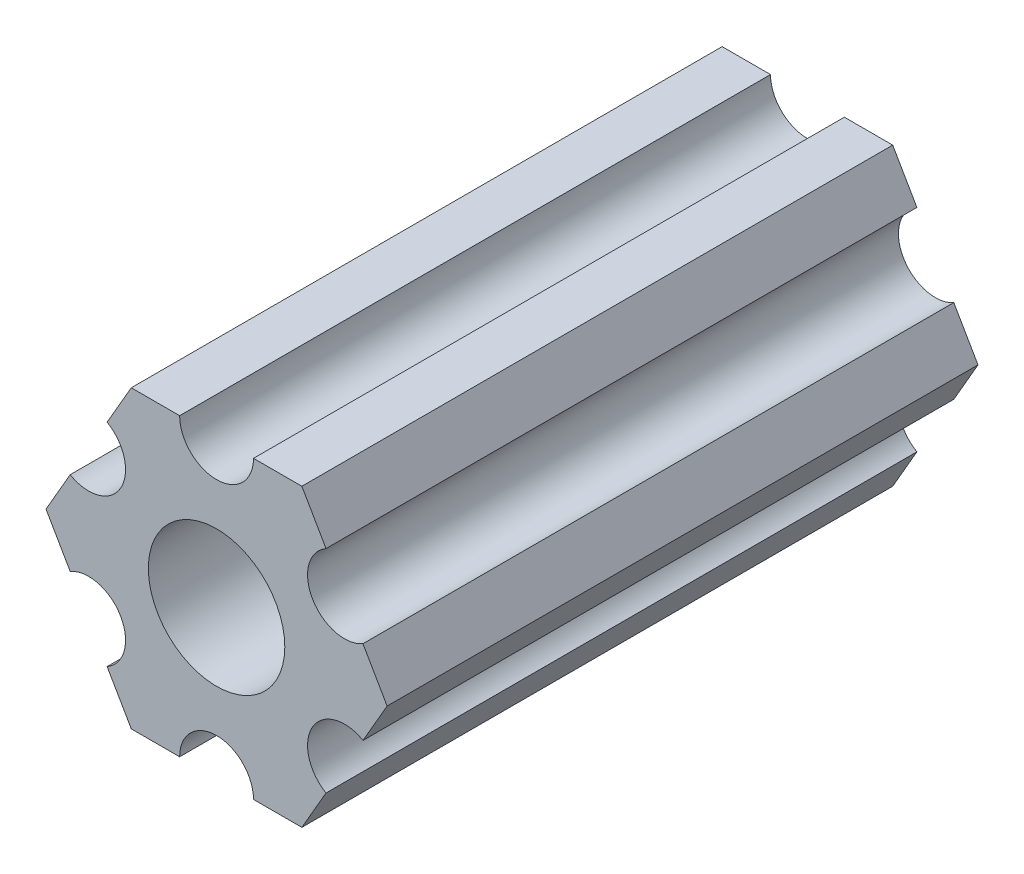
from build123d import *

# Parameters (mm, degrees)
SKETCH1_R           = 2.9337
BOSS_EXTRUDE1_DEPTH = 25.4


with BuildPart() as part:
    # Sketch1 → Boss-Extrude1 (new body)
    with BuildSketch(Plane(origin=(0, 0, 0), x_dir=(-1, 0, 0), z_dir=(0, 0, -1))):
        with BuildLine():
            Line((-4.70551159, -4.549815043), (-3.666174521, -6.349999904))
            Line((-3.666174521, -6.349999904), (-1.587500385, -6.349999904))
            ThreePointArc((-1.587500385, -6.349999904), (-3.85e-07, -4.762499904), (1.587499615, -6.349999904))
            Line((1.587499615, -6.349999904), (3.666173825, -6.349999904))
            Line((3.666173825, -6.349999904), (4.705510942, -4.54981524))
            ThreePointArc((4.705510942, -4.54981524), (4.124445629, -2.381249907), (6.293010962, -1.800184594))
            Line((6.293010962, -1.800184594), (7.332348079, 7e-08))
            Line((7.332348079, 7e-08), (6.293011217, 1.800184685))
            ThreePointArc((6.293011217, 1.800184685), (4.124445939, 2.381250203), (4.705511457, 4.549815481))
            Line((4.705511457, 4.549815481), (3.666174521, 6.350000222))
            Line((3.666174521, 6.350000222), (1.587500385, 6.350000222))
            ThreePointArc((1.587500385, 6.350000222), (3.85e-07, 4.762500222), (-1.587499615, 6.350000222))
            Line((-1.587499615, 6.350000222), (-3.666173825, 6.350000222))
            Line((-3.666173825, 6.350000222), (-4.705511038, 4.549815614))
            ThreePointArc((-4.705511038, 4.549815614), (-4.124445841, 2.38125025), (-6.293011205, 1.800185053))
            Line((-6.293011205, 1.800185053), (-7.332348419, 4.44e-07))
            Line((-7.332348419, 4.44e-07), (-6.293011423, -1.80018429))
            ThreePointArc((-6.293011423, -1.80018429), (-4.12444613, -2.38124975), (-4.70551159, -4.549815043))
        make_face()
        with Locations(Location((0, 0, 0), (0, 0, 180))):
            Circle(SKETCH1_R, mode=Mode.SUBTRACT)
    extrude(amount=BOSS_EXTRUDE1_DEPTH)


solid = part.part
